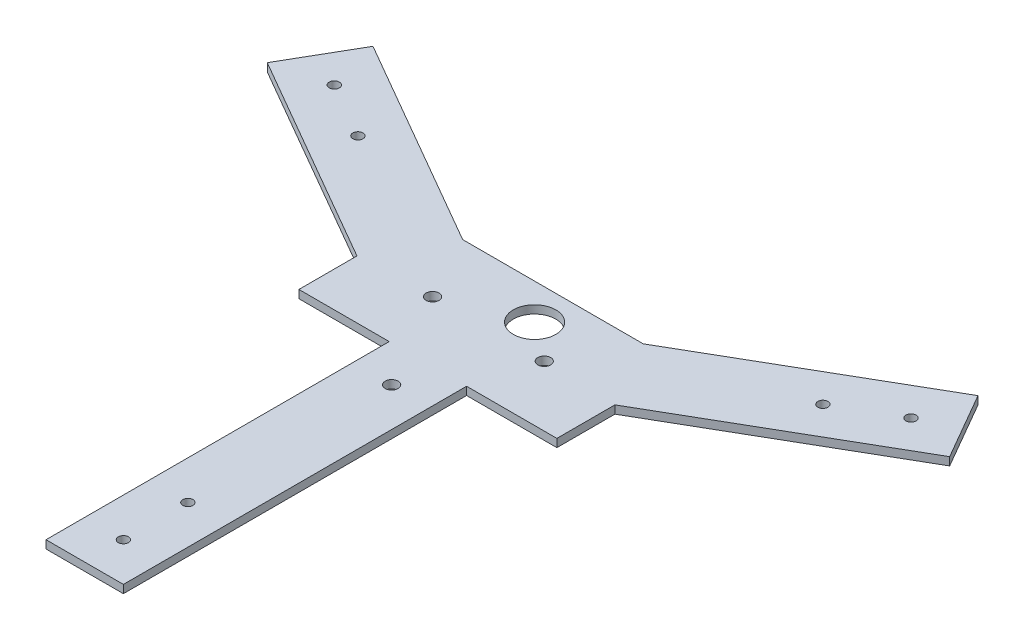
from build123d import *

# Parameters (mm, degrees)
SKETCH1_R           = 1.27
BOSS_EXTRUDE2_DEPTH = 1.5875
SKETCH3_R           = 4.191
CUT_EXTRUDE1_DEPTH  = 2.54
SKETCH4_R           = 1
SKETCH4_R_2         = 0.999998
CUT_EXTRUDE2_DEPTH  = 2.54


with BuildPart() as part:
    # Sketch1 → Boss-Extrude2 (new body)
    with BuildSketch(Plane(origin=(0, 0, 0), x_dir=(1, 0, 0), z_dir=(0, 1, 0))):
        Polygon((-41.794385987, 35.56), (0, 11.43), (0, 0), (17.78, 0), (17.78, -67.587878735), (33.02, -67.587878735), (33.02, 0), (50.8, 0), (50.8, 11.43), (92.594385987, 35.56), (84.974385987, 48.758227154), (43.18, 24.628227154), (7.62, 24.628227154), (-34.174385987, 48.758227154), align=None)
        with Locations(Location((36.398522628, 11.914121265, 0), (0, 0, 270))):
            Circle(SKETCH1_R, mode=Mode.SUBTRACT)
        with Locations(Location((14.401477372, 11.914121265, 0), (0, 0, 270))):
            Circle(SKETCH1_R, mode=Mode.SUBTRACT)
        with Locations(Location((25.4, -7.135878735, 0), (0, 0, 270))):
            Circle(SKETCH1_R, mode=Mode.SUBTRACT)
    extrude(amount=BOSS_EXTRUDE2_DEPTH)

    # Sketch3 → Cut-Extrude1 (cut)
    with BuildSketch(Plane(origin=(0, 1.5875, 0), x_dir=(1, 0, 0), z_dir=(0, 1, 0))):
        with Locations(Location((28.778522628, 17.627987154, 0), (0, 0, 270))):
            Circle(SKETCH3_R)
    extrude(amount=-CUT_EXTRUDE1_DEPTH, mode=Mode.SUBTRACT)

    # Sketch4 → Cut-Extrude2 (cut)
    with BuildSketch(Plane(origin=(0, 1.5875, 0), x_dir=(1, 0, 0), z_dir=(0, 1, 0))):
        with Locations(Location((25.4, -59.967878735, 0), (0, 0, 270))):
            Circle(SKETCH4_R)
        with Locations(Location((25.4, -47.267878735, 0), (0, 0, 270))):
            Circle(SKETCH4_R_2)
        with Locations(Location((-20.386749782, 31.999113577, 0), (0, 0, 270))):
            Circle(SKETCH4_R)
        with Locations(Location((-31.38527241, 38.349113577, 0), (0, 0, 270))):
            Circle(SKETCH4_R)
        with Locations(Location((82.18527241, 38.349113577, 0), (0, 0, 270))):
            Circle(SKETCH4_R)
        with Locations(Location((71.186749782, 31.999113577, 0), (0, 0, 270))):
            Circle(SKETCH4_R)
    extrude(amount=-CUT_EXTRUDE2_DEPTH, mode=Mode.SUBTRACT)


solid = part.part
